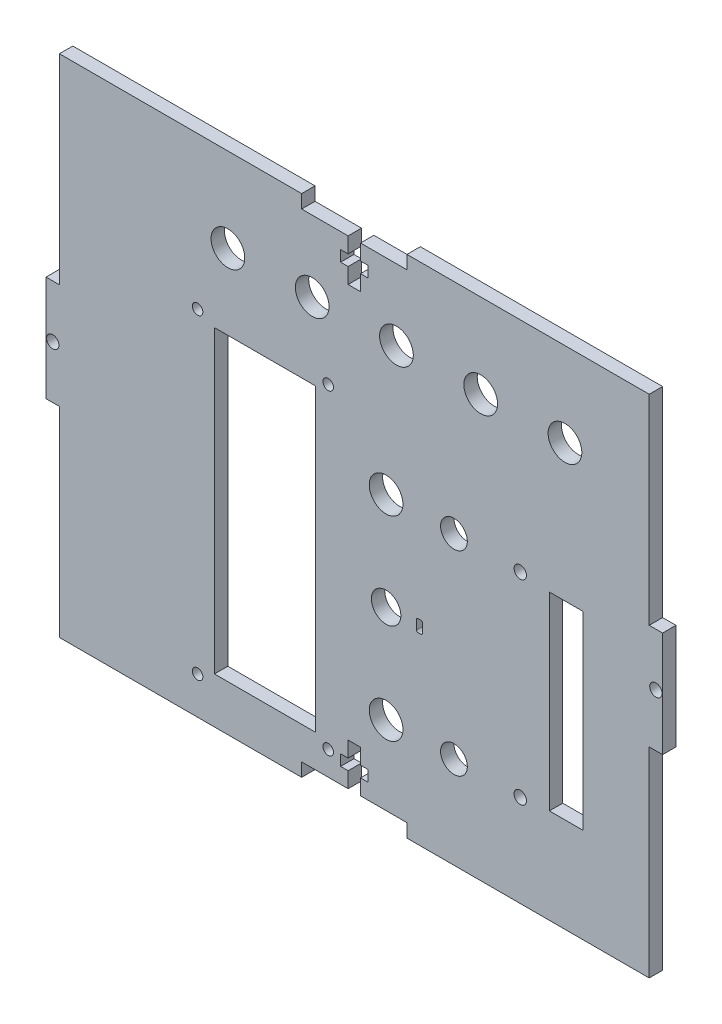
from build123d import *

# Parameters (mm, degrees)
SKETCH1_R           = 1.47
BOSS_EXTRUDE1_DEPTH = 1.5875
SKETCH3_W           = 8
SKETCH3_H           = 45
CUT_EXTRUDE1_DEPTH  = 95.681895049
SKETCH4_W           = 24
SKETCH4_H           = 71.2
CUT_EXTRUDE2_DEPTH  = 95.681895049
CUT_EXTRUDE4_DEPTH  = 95.681895049
SKETCH6_R           = 4
CUT_EXTRUDE5_DEPTH  = 95.681895049
SKETCH9_R           = 1.25
SKETCH9_R_2         = 1.47
CUT_EXTRUDE6_DEPTH  = 95.681895049
SKETCH12_R          = 4
SKETCH12_R_2        = 3.5
SKETCH12_R_3        = 3.175
CUT_EXTRUDE7_DEPTH  = 95.681895049


with BuildPart() as part:
    # Sketch1 → Boss-Extrude1 (new, symmetric)
    with BuildSketch(Plane.XY):
        Polygon((-12.5, 60), (-70, 60), (-70, 12.5), (-73.175, 12.5), (-73.175, -12.5), (-70, -12.5), (-70, -60), (-12.5, -60), (-12.5, -56.825), (-1.47, -56.825), (-1.47, -53.125), (-3.25, -53.125), (-3.25, -50.525), (-1.47, -50.525), (-1.47, -46.825), (1.47, -46.825), (1.47, -50.525), (3.25, -50.525), (3.25, -53.125), (1.47, -53.125), (1.47, -56.825), (12.5, -56.825), (12.5, -60), (70, -60), (70, -12.5), (73.175, -12.5), (73.175, 12.5), (70, 12.5), (70, 60), (12.5, 60), (12.5, 56.825), (1.47, 56.825), (1.47, 53.125), (3.25, 53.125), (3.25, 50.525), (1.47, 50.525), (1.47, 46.825), (-1.47, 46.825), (-1.47, 50.525), (-3.25, 50.525), (-3.25, 53.125), (-1.47, 53.125), (-1.47, 56.825), (-12.5, 56.825), align=None)
        with Locations((-71.5875, 0)):
            Circle(SKETCH1_R, mode=Mode.SUBTRACT)
        with Locations(Location((71.5875, 0, 0), (0, 0, 180))):
            Circle(SKETCH1_R, mode=Mode.SUBTRACT)
    extrude(amount=BOSS_EXTRUDE1_DEPTH, both=True)

    # Sketch3 → Cut-Extrude1 (cut, through all)
    with BuildSketch(Plane(origin=(0, 0, -1.5875), x_dir=(-1, 0, 0), z_dir=(0, 0, -1))):
        with Locations((-50.3, -15)):
            Rectangle(SKETCH3_W, SKETCH3_H)
    extrude(amount=-CUT_EXTRUDE1_DEPTH, mode=Mode.SUBTRACT)

    # Sketch4 → Cut-Extrude2 (cut, through all)
    with BuildSketch(Plane(origin=(0, 0, -1.5875), x_dir=(-1, 0, 0), z_dir=(0, 0, -1))):
        with Locations((21.2, -13.494459363)):
            Rectangle(SKETCH4_W, SKETCH4_H)
    extrude(amount=-CUT_EXTRUDE2_DEPTH, mode=Mode.SUBTRACT)

    # Sketch5 → Cut-Extrude4 (cut, through all)
    with BuildSketch(Plane(origin=(0, 0, -1.5875), x_dir=(-1, 0, 0), z_dir=(0, 0, -1))):
        with BuildLine():
            Line((-15.153420736, -16.45), (-15.77915134, -16.45))
            ThreePointArc((-15.77915134, -16.45), (-16.043498683, -16.350200736), (-16.175937675, -16.10060241))
            ThreePointArc((-16.175937675, -16.10060241), (-16.245834875, -15), (-16.175937675, -13.89939759))
            ThreePointArc((-16.175937675, -13.89939759), (-16.043498683, -13.649799264), (-15.77915134, -13.55))
            Line((-15.77915134, -13.55), (-15.153420736, -13.55))
            ThreePointArc((-15.153420736, -13.55), (-14.870578023, -13.667157288), (-14.753420736, -13.95))
            Line((-14.753420736, -13.95), (-14.753420736, -16.05))
            ThreePointArc((-14.753420736, -16.05), (-14.870578023, -16.332842712), (-15.153420736, -16.45))
        make_face()
    extrude(amount=-CUT_EXTRUDE4_DEPTH, mode=Mode.SUBTRACT)

    # Sketch6 → Cut-Extrude5 (cut, through all)
    with BuildSketch(Plane(origin=(0, 0, -1.5875), x_dir=(-1, 0, 0), z_dir=(0, 0, -1))):
        with Locations((30, 40)):
            Circle(SKETCH6_R)
        with Locations((10, 40)):
            Circle(SKETCH6_R)
        with Locations((-10, 40)):
            Circle(SKETCH6_R)
        with Locations((-30, 40)):
            Circle(SKETCH6_R)
        with Locations((-50, 40)):
            Circle(SKETCH6_R)
    extrude(amount=-CUT_EXTRUDE5_DEPTH, mode=Mode.SUBTRACT)

    # Sketch9 → Cut-Extrude6 (cut, through all)
    with BuildSketch(Plane.XY.offset(1.5875)):
        with Locations((-37.2, 23.905540637)):
            Circle(SKETCH9_R)
        with Locations((-6.2, 23.905540637)):
            Circle(SKETCH9_R)
        with Locations((-6.2, -51.094459363)):
            Circle(SKETCH9_R)
        with Locations((-37.2, -51.094459363)):
            Circle(SKETCH9_R)
        with Locations((39.3875, 8.16125846)):
            Circle(SKETCH9_R_2)
        with Locations((39.3875, -38.16125846)):
            Circle(SKETCH9_R_2)
    extrude(amount=-CUT_EXTRUDE6_DEPTH, mode=Mode.SUBTRACT)

    # Sketch12 → Cut-Extrude7 (cut, through all)
    with BuildSketch(Plane(origin=(0, 0, -1.5875), x_dir=(-1, 0, 0), z_dir=(0, 0, -1))):
        with Locations((-7.545834875, -38.16125846)):
            Circle(SKETCH12_R)
        with Locations((-7.545834875, 8.16125846)):
            Circle(SKETCH12_R)
        with Locations((-7.545834875, -15)):
            Circle(SKETCH12_R_2)
        with Locations((-23.65, -38.16125846)):
            Circle(SKETCH12_R_3)
        with Locations((-23.65, 8.16125846)):
            Circle(SKETCH12_R_3)
    extrude(amount=-CUT_EXTRUDE7_DEPTH, mode=Mode.SUBTRACT)


solid = part.part
